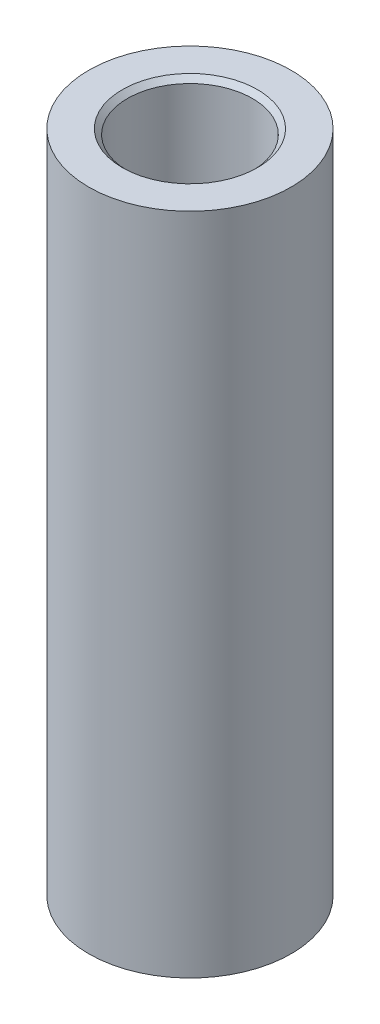
from build123d import *

# Parameters (mm, degrees)
SKETCH1_R                = 7.9375
BOSS_EXTRUDE1_DEPTH      = 52.07
W_0_386_DIAMETER_HOLE1_D = 9.8044
CHAMFER1_SIZE            = 0.4


with BuildPart() as part:
    # Sketch1 → Boss-Extrude1 (new body)
    with BuildSketch(Plane(origin=(0, 0, 0), x_dir=(1, 0, 0), z_dir=(0, 1, 0))):
        with Locations(Location((0, 0, 0), (0, 0, 270))):
            Circle(SKETCH1_R)
    extrude(amount=BOSS_EXTRUDE1_DEPTH)

    # W (0.386) Diameter Hole1 (through all)
    with Locations(Plane(origin=(0, 52.07, 0), x_dir=(1, 0, 0), z_dir=(0, 1, 0))):
        with Locations((0, 0)):
            Hole(W_0_386_DIAMETER_HOLE1_D / 2)

    # Chamfer1
    chamfer1_edges = [part.edges().sort_by_distance(p)[0] for p in [
        (4.9022, 52.07, 0),
        (4.9022, 0, 0),
    ]]
    chamfer(chamfer1_edges, length=CHAMFER1_SIZE)


solid = part.part
